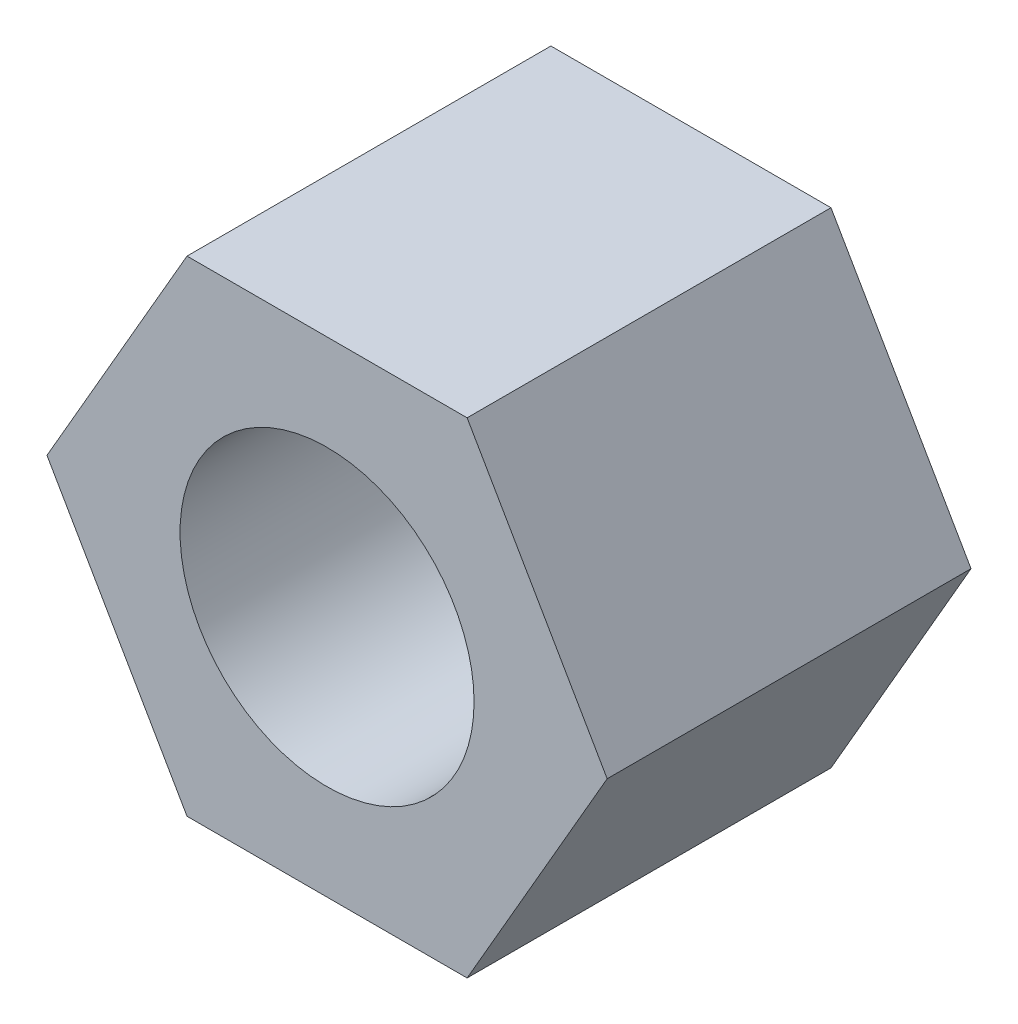
from build123d import *

# Parameters (mm, degrees)
S01_HEXAGON_AND_NOMINAL_THREAD_ENVELOP_R       = 3.03
F_01_HEXAGON_AND_NOMINAL_THREAD_ENVELOPE_DEPTH = 7.5


with BuildPart() as part:
    # S01 - Hexagon and nominal thread envelope → 01 - Hexagon and nominal thread envelope (new body)
    with BuildSketch(Plane.XY):
        Polygon((5.773502692, 0), (2.886751346, 5), (-2.886751346, 5), (-5.773502692, 0), (-2.886751346, -5), (2.886751346, -5), align=None)
        Circle(S01_HEXAGON_AND_NOMINAL_THREAD_ENVELOP_R, mode=Mode.SUBTRACT)
    extrude(amount=F_01_HEXAGON_AND_NOMINAL_THREAD_ENVELOPE_DEPTH)


solid = part.part
